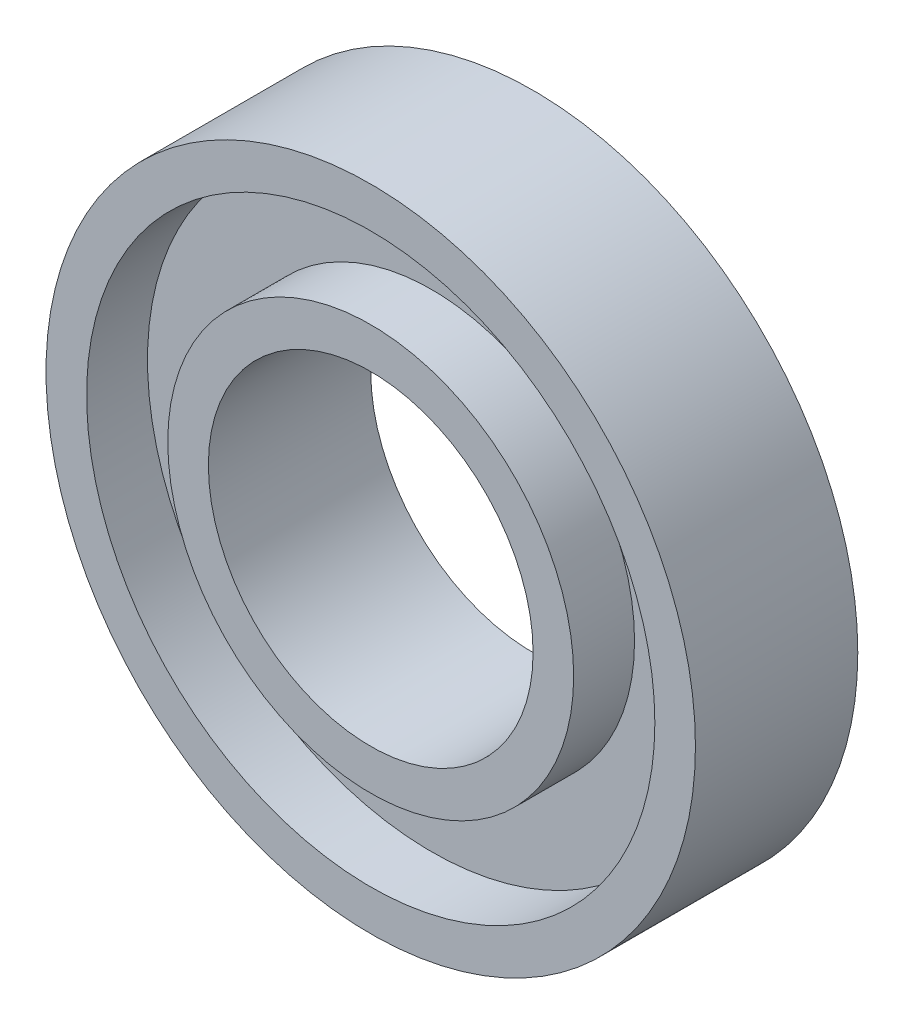
from build123d import *

# Parameters (mm, degrees)
SKETCH_1_R          = 8
SKETCH_1_R_2        = 4
EXTRUDE_1_DEPTH     = 4
SKETCH_2_R          = 7
SKETCH_2_R_2        = 5
CUT_EXTRUDE_1_DEPTH = 1.5


with BuildPart() as part:
    # 草图1 → 凸台-拉伸1 (new body)
    with BuildSketch(Plane.XY):
        Circle(SKETCH_1_R)
        Circle(SKETCH_1_R_2, mode=Mode.SUBTRACT)
    extrude(amount=EXTRUDE_1_DEPTH)

    # 草图2 → 切除-拉伸1 (cut)
    with BuildSketch(Plane.XY.offset(4)):
        Circle(SKETCH_2_R)
        Circle(SKETCH_2_R_2, mode=Mode.SUBTRACT)
    cut_extrude_1 = extrude(amount=-CUT_EXTRUDE_1_DEPTH, mode=Mode.SUBTRACT)

    # 镜向1: 切除-拉伸1 across plane
    add(cut_extrude_1.mirror(Plane.XY.offset(2)), mode=Mode.SUBTRACT)


solid = part.part
